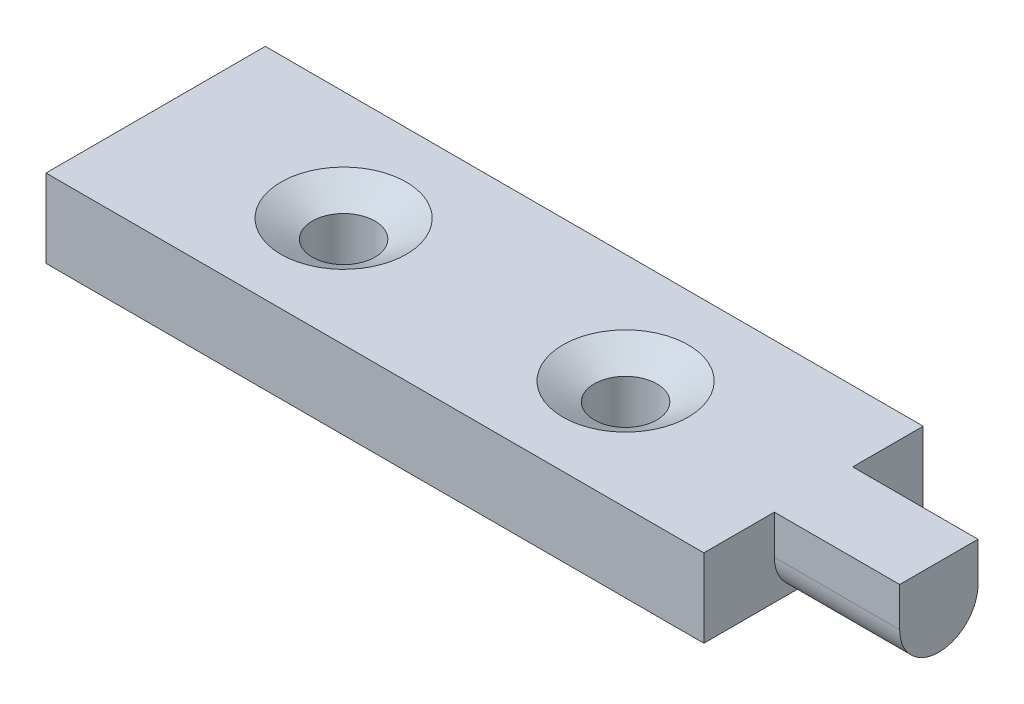
from build123d import *

# Parameters (mm, degrees)
SKETCH1_W           = 50
SKETCH1_H           = 14
SKETCH1_R           = 2
BOSS_EXTRUDE1_DEPTH = 5
CUT_EXTRUDE1_DEPTH  = 8
CHAMFER1_SIZE       = 2
CHAMFER1_SIZE2      = 1.154700538


with BuildPart() as part:
    # Sketch1 → Boss-Extrude1 (new body)
    with BuildSketch(Plane(origin=(0, 0, 0), x_dir=(1, 0, 0), z_dir=(0, 1, 0))):
        with Locations((0.901639344, 1.721311475)):
            Rectangle(SKETCH1_W, SKETCH1_H)
        with Locations(Location((5.901639344, 1.721311475, 0), (0, 0, 270))):
            Circle(SKETCH1_R, mode=Mode.SUBTRACT)
        with Locations(Location((-12.098360656, 1.721311475, 0), (0, 0, 270))):
            Circle(SKETCH1_R, mode=Mode.SUBTRACT)
    extrude(amount=BOSS_EXTRUDE1_DEPTH)

    # Sketch2 → Cut-Extrude1 (cut)
    with BuildSketch(Plane(origin=(25.901639344, 0, 0), x_dir=(0, 0, -1), z_dir=(1, 0, 0))):
        with BuildLine():
            Line((-0.778688525, 5), (-5.278688525, 5))
            Line((-5.278688525, 5), (-5.278688525, 0))
            Line((-5.278688525, 0), (1.721311475, 0))
            ThreePointArc((1.721311475, 0), (-0.046455478, 0.732233047), (-0.778688525, 2.5))
            Line((-0.778688525, 2.5), (-0.778688525, 5))
        make_face()
        with BuildLine():
            ThreePointArc((4.221311475, 2.5), (3.489078428, 0.732233047), (1.721311475, 0))
            Line((1.721311475, 0), (8.721311475, 0))
            Line((8.721311475, 0), (8.721311475, 5))
            Line((8.721311475, 5), (4.221311475, 5))
            Line((4.221311475, 5), (4.221311475, 2.5))
        make_face()
    extrude(amount=-CUT_EXTRUDE1_DEPTH, mode=Mode.SUBTRACT)

    # Chamfer1
    chamfer1_edges = [part.edges().sort_by_distance(p)[0] for p in [
        (5.901639344, 5, -3.721311475),
        (-12.098360656, 5, -3.721311475),
    ]]
    chamfer1_side = [part.faces().sort_by_distance(p)[0] for p in [
        (-1.439620717, 5, -1.721311475),
    ]]
    chamfer(chamfer1_edges, length=CHAMFER1_SIZE, length2=CHAMFER1_SIZE2, reference=chamfer1_side[0])


solid = part.part
